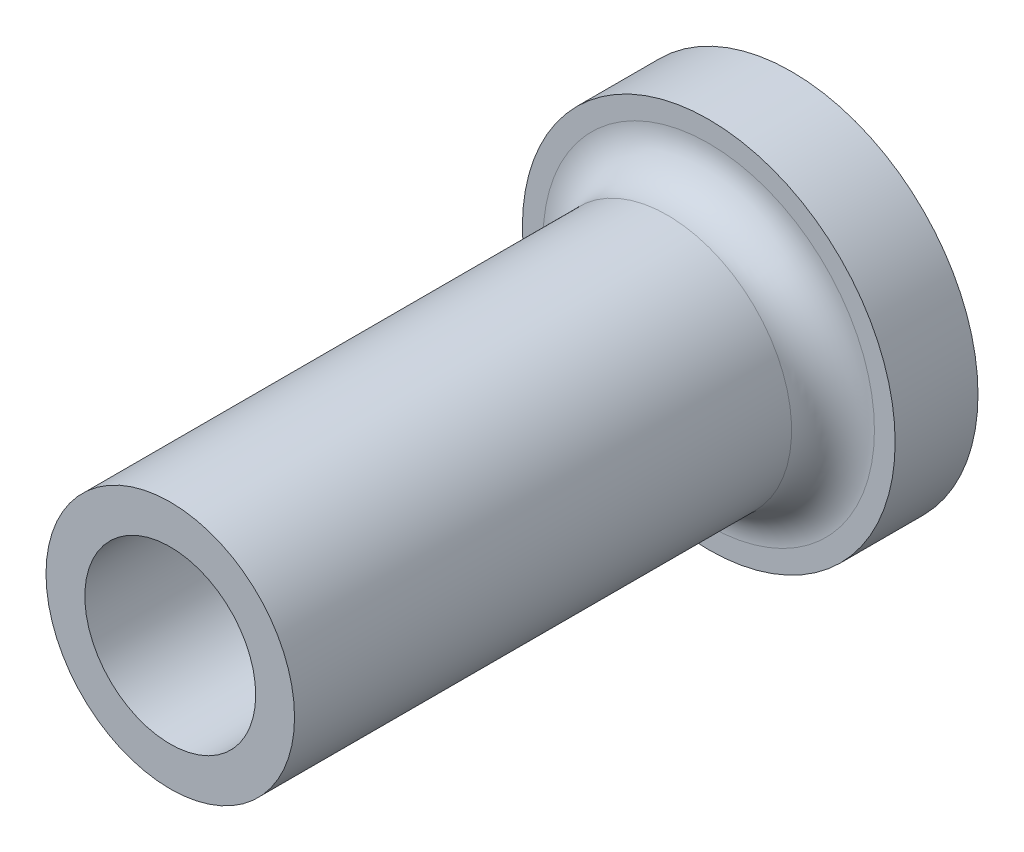
from build123d import *

# Parameters (mm, degrees)
SKETCH1_R           = 6
SKETCH1_R_2         = 4.125
BOSS_EXTRUDE1_DEPTH = 30
SKETCH2_R           = 9
SKETCH2_R_2         = 4.125
BOSS_EXTRUDE2_DEPTH = 4
FILLET1_R           = 2


with BuildPart() as part:
    # Sketch1 → Boss-Extrude1 (new body)
    with BuildSketch(Plane.XY):
        Circle(SKETCH1_R)
        Circle(SKETCH1_R_2, mode=Mode.SUBTRACT)
    extrude(amount=BOSS_EXTRUDE1_DEPTH)

    # Sketch2 → Boss-Extrude2 (add)
    with BuildSketch(Plane(origin=(0, 0, 0), x_dir=(-1, 0, 0), z_dir=(0, 0, -1))):
        Circle(SKETCH2_R)
        with Locations(Location((0, 0, 0), (0, 0, 180))):
            Circle(SKETCH2_R_2, mode=Mode.SUBTRACT)
    extrude(amount=-BOSS_EXTRUDE2_DEPTH)

    # Fillet1
    fillet1_edges = [part.edges().sort_by_distance(p)[0] for p in [
        (-6, 0, 4),
    ]]
    fillet(fillet1_edges, radius=FILLET1_R)


solid = part.part
